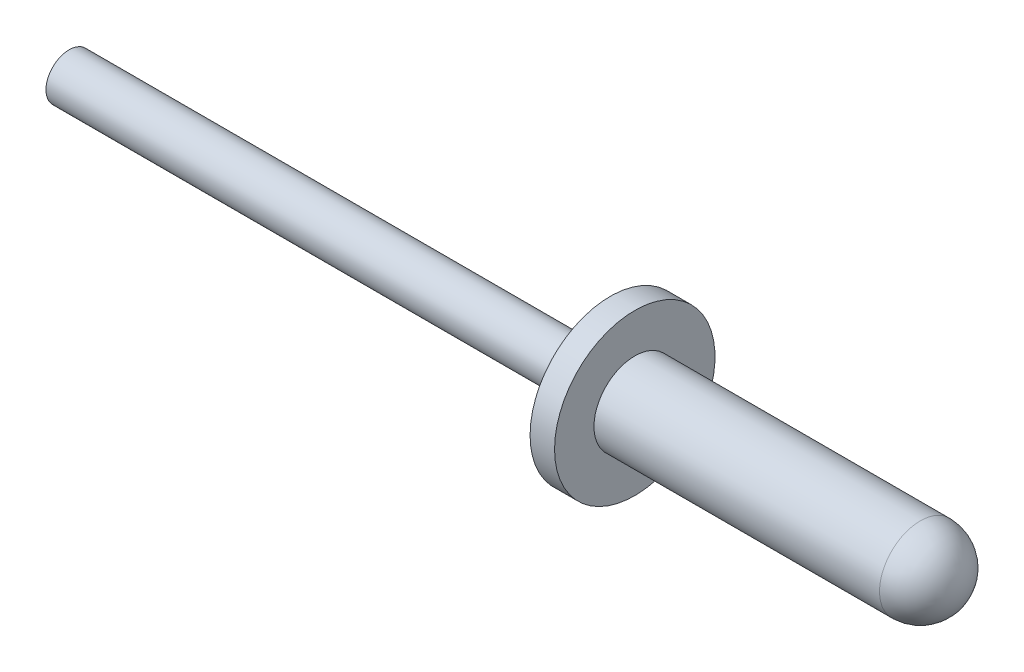
from build123d import *

# Parameters (mm, degrees)
SKETCH1_R           = 1.5
BOSS_EXTRUDE1_DEPTH = 10.5
SKETCH2_R           = 2.95
BOSS_EXTRUDE2_DEPTH = 0.9
SWEEP1_PROFILE_R    = 0.85


with BuildPart() as part:
    # Sketch1 → Boss-Extrude1 (new body)
    with BuildSketch(Plane(origin=(0, 0, 0), x_dir=(0, 0, -1), z_dir=(1, 0, 0))):
        with Locations(Location((0, 0, 0), (0, 0, 180))):
            Circle(SKETCH1_R)
    extrude(amount=BOSS_EXTRUDE1_DEPTH)

    # Sketch8 → Revolve1 (revolve)
    with BuildSketch(Plane(origin=(10.5, 0, 0), x_dir=(0, 0, -1), z_dir=(1, 0, 0))):
        with BuildLine():
            Line((1.5, 0), (-1.5, 0))
            ThreePointArc((-1.5, 0), (0, 1.5), (1.5, 0))
        make_face()
    revolve(axis=Axis((10.5, 0, -1.5), (0, 0, 1)))

    # Sketch2 → Boss-Extrude2 (add)
    with BuildSketch(Plane.ZY):
        Circle(SKETCH2_R)
    extrude(amount=BOSS_EXTRUDE2_DEPTH)

    # Sweep1: sweep along a path in Sketch3
    with BuildLine(Plane.XY) as sweep1_path:
        Line((-0.9, 0), (-20.8, 0))
    # Sweep1 profile (on start of the path) → Sweep1 (sweep)
    with BuildSketch(Plane(origin=(-0.9, 0, 0), x_dir=(0, -1, 0), z_dir=(-1, 0, 0))):
        Circle(SWEEP1_PROFILE_R)
    sweep(path=sweep1_path.line)


solid = part.part
